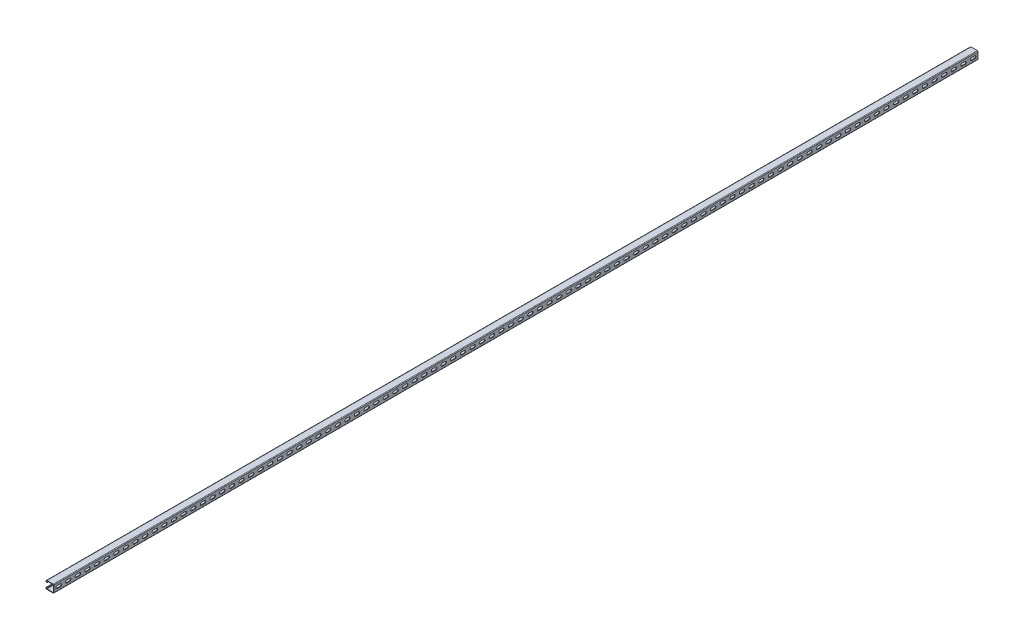
from build123d import *

# Parameters (mm, degrees)
BOSS_EXTRUDE1_DEPTH = 4876.8
CUT_EXTRUDE1_DEPTH  = 2.794
LPATTERN1_COUNT     = 96
LPATTERN1_PITCH     = 50.8


with BuildPart() as part:
    # Sketch1 → Boss-Extrude1 (new body)
    with BuildSketch(Plane.XY):
        with BuildLine():
            Line((-36.22675, 20.6375), (-3.46075, 20.6375))
            ThreePointArc((-3.46075, 20.6375), (-1.013630207, 19.623869793), (0, 17.17675))
            Line((0, 17.17675), (0, -17.17675))
            ThreePointArc((0, -17.17675), (-1.013630207, -19.623869793), (-3.46075, -20.6375))
            Line((-3.46075, -20.6375), (-36.22675, -20.6375))
            ThreePointArc((-36.22675, -20.6375), (-39.796401808, -19.158901808), (-41.275, -15.58925))
            Line((-41.275, -15.58925), (-41.275, -14.57325))
            ThreePointArc((-41.275, -14.57325), (-40.261369793, -12.126130207), (-37.81425, -11.1125))
            Line((-37.81425, -11.1125), (-35.5346, -11.1125))
            ThreePointArc((-35.5346, -11.1125), (-34.1376, -12.5095), (-35.5346, -13.9065))
            Line((-35.5346, -13.9065), (-37.81425, -13.9065))
            ThreePointArc((-37.81425, -13.9065), (-38.285713446, -14.101786554), (-38.481, -14.57325))
            Line((-38.481, -14.57325), (-38.481, -15.58925))
            ThreePointArc((-38.481, -15.58925), (-37.820745461, -17.183245461), (-36.22675, -17.8435))
            Line((-36.22675, -17.8435), (-3.46075, -17.8435))
            ThreePointArc((-3.46075, -17.8435), (-2.989286554, -17.648213446), (-2.794, -17.17675))
            Line((-2.794, -17.17675), (-2.794, 17.17675))
            ThreePointArc((-2.794, 17.17675), (-2.989286554, 17.648213446), (-3.46075, 17.8435))
            Line((-3.46075, 17.8435), (-36.22675, 17.8435))
            ThreePointArc((-36.22675, 17.8435), (-37.820745461, 17.183245461), (-38.481, 15.58925))
            Line((-38.481, 15.58925), (-38.481, 14.57325))
            ThreePointArc((-38.481, 14.57325), (-38.285713446, 14.101786554), (-37.81425, 13.9065))
            Line((-37.81425, 13.9065), (-35.5346, 13.9065))
            ThreePointArc((-35.5346, 13.9065), (-34.1376, 12.5095), (-35.5346, 11.1125))
            Line((-35.5346, 11.1125), (-37.81425, 11.1125))
            ThreePointArc((-37.81425, 11.1125), (-40.261369793, 12.126130207), (-41.275, 14.57325))
            Line((-41.275, 14.57325), (-41.275, 15.58925))
            ThreePointArc((-41.275, 15.58925), (-39.796401808, 19.158901808), (-36.22675, 20.6375))
        make_face()
    extrude(amount=-BOSS_EXTRUDE1_DEPTH)

    # Sketch2 → Cut-Extrude1 (cut)
    with BuildSketch(Plane(origin=(0, 0, 0), x_dir=(0, 0, -1), z_dir=(1, 0, 0))):
        with BuildLine():
            Line((18.25625, 7.14375), (32.54375, 7.14375))
            ThreePointArc((32.54375, 7.14375), (39.6875, 0), (32.54375, -7.14375))
            Line((32.54375, -7.14375), (18.25625, -7.14375))
            ThreePointArc((18.25625, -7.14375), (11.1125, 0), (18.25625, 7.14375))
        make_face()
    cut_extrude1 = extrude(amount=-CUT_EXTRUDE1_DEPTH, mode=Mode.SUBTRACT)

    # LPattern1: Cut-Extrude1 ×96
    with Locations(*[(0, 0, -i * LPATTERN1_PITCH) for i in range(1, LPATTERN1_COUNT)]):
        add(cut_extrude1, mode=Mode.SUBTRACT)


solid = part.part
